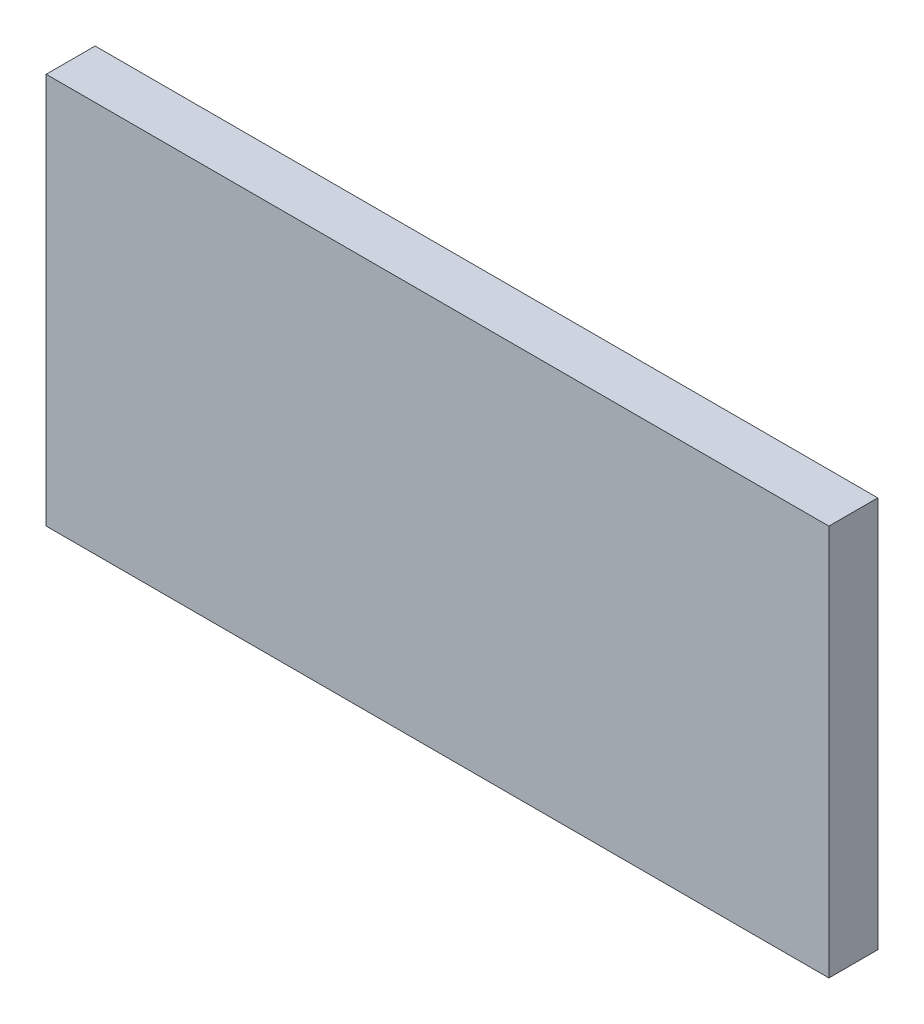
from build123d import *

# Parameters (mm, degrees)
SKETCH1_W           = 50.8
SKETCH1_H           = 25.4
BOSS_EXTRUDE1_DEPTH = 3.175


with BuildPart() as part:
    # Sketch1 → Boss-Extrude1 (new body)
    with BuildSketch(Plane.XY):
        with Locations((25.4, 12.7)):
            Rectangle(SKETCH1_W, SKETCH1_H)
    extrude(amount=BOSS_EXTRUDE1_DEPTH)


solid = part.part
